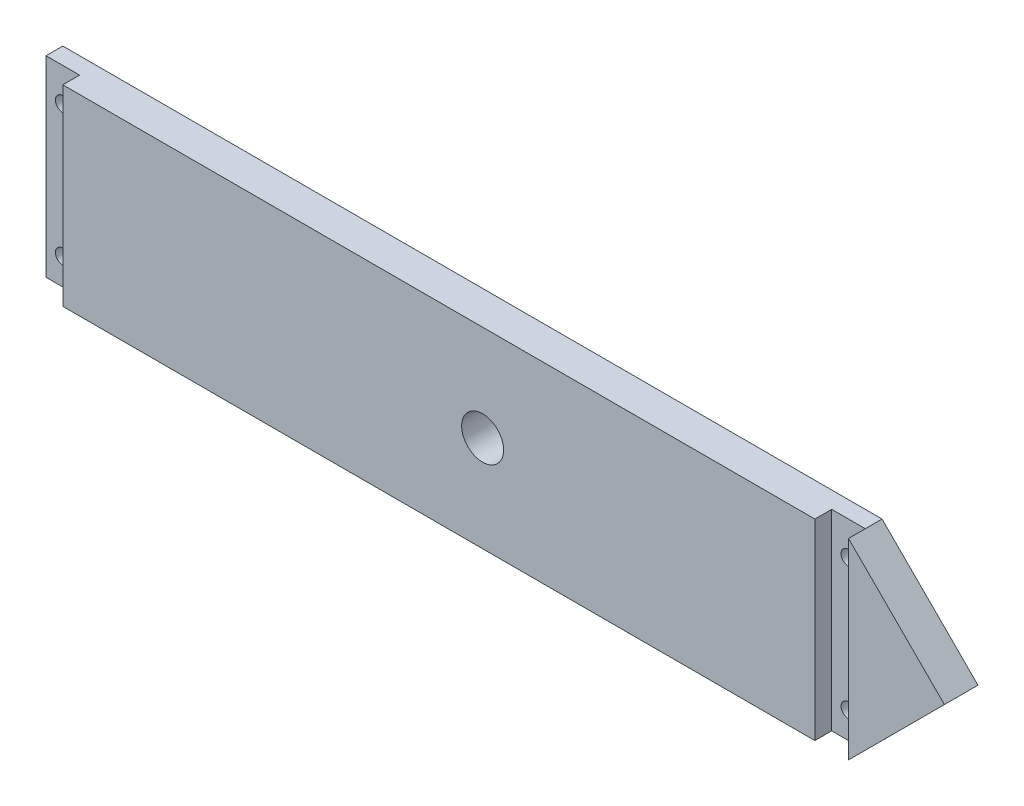
from build123d import *

# Parameters (mm, degrees)
SKETCH1_W                                         = 173.0375
SKETCH1_H                                         = 36.27882
EXTRUDE2_DEPTH                                    = 6.35
SKETCH8_W                                         = 6.35
SKETCH8_H                                         = 36.27882
EXTRUDE7_DEPTH                                    = 3.175
EXTRUDE8_DEPTH                                    = 89.627618702
SKETCH19_R                                        = 3.96875
EXTRUDE9_DEPTH                                    = 89.627618702
CSK_FOR_3_FLAT_HEAD_SOCKET_CAP_SCREW1_D           = 2.794
CSK_FOR_3_FLAT_HEAD_SOCKET_CAP_SCREW1_CSINK_D     = 5.51688
CSK_FOR_3_FLAT_HEAD_SOCKET_CAP_SCREW1_CSINK_ANGLE = 82
CSK_FOR_3_FLAT_HEAD_SOCKET_CAP_SCREW2_D           = 2.794
CSK_FOR_3_FLAT_HEAD_SOCKET_CAP_SCREW2_CSINK_D     = 5.51688
CSK_FOR_3_FLAT_HEAD_SOCKET_CAP_SCREW2_CSINK_ANGLE = 82


with BuildPart() as part:
    # Sketch1 → Extrude2 (new body)
    with BuildSketch(Plane.XY):
        Rectangle(SKETCH1_W, SKETCH1_H)
    extrude(amount=EXTRUDE2_DEPTH)

    # Sketch8 → Extrude7 (cut)
    with BuildSketch(Plane.XY.offset(6.35)):
        with Locations((-83.34375, 0)):
            Rectangle(SKETCH8_W, SKETCH8_H)
        with Locations((65.20561, 0)):
            Rectangle(SKETCH8_W, SKETCH8_H)
    extrude(amount=-EXTRUDE7_DEPTH, mode=Mode.SUBTRACT)

    # Sketch18 → Extrude8 (cut, through all)
    with BuildSketch(Plane.XY.offset(6.35)):
        Polygon((86.51875, 0), (68.38061, 18.13941), (113.519162523, 18.13941), (113.519162523, -18.13941), (68.38061, -18.13941), align=None)
    extrude(amount=-EXTRUDE8_DEPTH, mode=Mode.SUBTRACT)

    # Sketch19 → Extrude9 (cut, through all)
    with BuildSketch(Plane.XY.offset(6.35)):
        with Locations((-0.79375, 0)):
            Circle(SKETCH19_R)
    extrude(amount=-EXTRUDE9_DEPTH, mode=Mode.SUBTRACT)

    # CSK for #3 Flat Head Socket Cap Screw1 (through all)
    with Locations(Plane(origin=(2.381898793, -14.071004552, 0), x_dir=(-1, 0, 0), z_dir=(0, 0, -1))):
        with Locations((-62.823711207, 25.860414552), (-62.823711207, 0.892214552)):
            CounterSinkHole(CSK_FOR_3_FLAT_HEAD_SOCKET_CAP_SCREW1_D / 2, CSK_FOR_3_FLAT_HEAD_SOCKET_CAP_SCREW1_CSINK_D / 2, counter_sink_angle=CSK_FOR_3_FLAT_HEAD_SOCKET_CAP_SCREW1_CSINK_ANGLE)

    # CSK for #3 Flat Head Socket Cap Screw2 (through all)
    with Locations(Plane(origin=(2.381898793, -14.071004552, 0), x_dir=(-1, 0, 0), z_dir=(0, 0, -1))):
        with Locations((85.725648793, 25.860414552), (85.725648793, 0.892214552)):
            CounterSinkHole(CSK_FOR_3_FLAT_HEAD_SOCKET_CAP_SCREW2_D / 2, CSK_FOR_3_FLAT_HEAD_SOCKET_CAP_SCREW2_CSINK_D / 2, counter_sink_angle=CSK_FOR_3_FLAT_HEAD_SOCKET_CAP_SCREW2_CSINK_ANGLE)


solid = part.part
